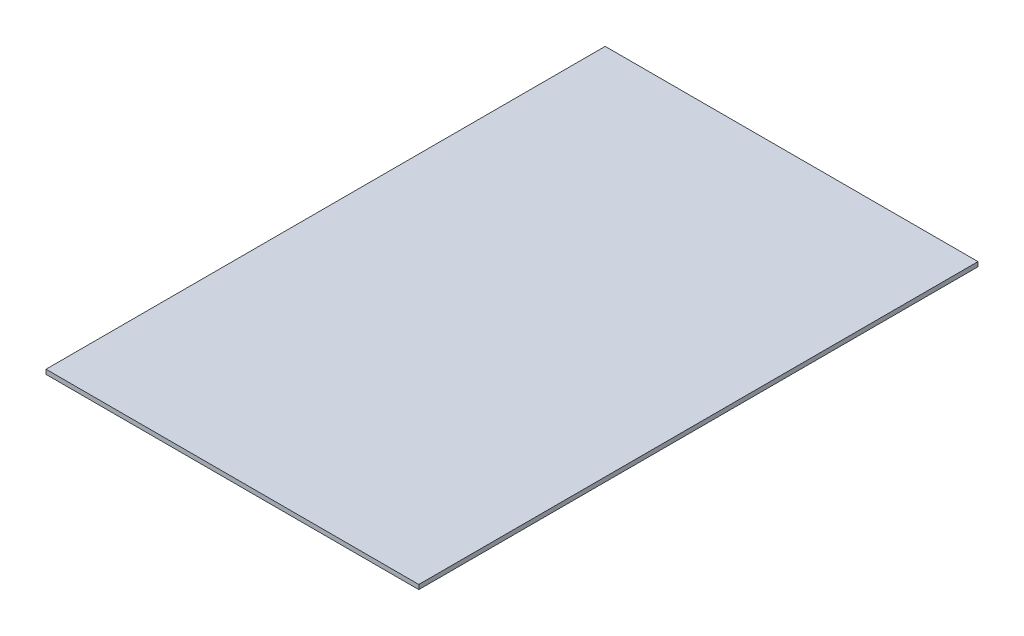
from build123d import *

# Parameters (mm, degrees)
SKETCH1_W           = 400
SKETCH1_H           = 600
BOSS_EXTRUDE1_DEPTH = 4.826


with BuildPart() as part:
    # Sketch1 → Boss-Extrude1 (new body)
    with BuildSketch(Plane(origin=(0, 0, 0), x_dir=(1, 0, 0), z_dir=(0, 1, 0))):
        with Locations((200, -300)):
            Rectangle(SKETCH1_W, SKETCH1_H)
    extrude(amount=BOSS_EXTRUDE1_DEPTH)


solid = part.part
